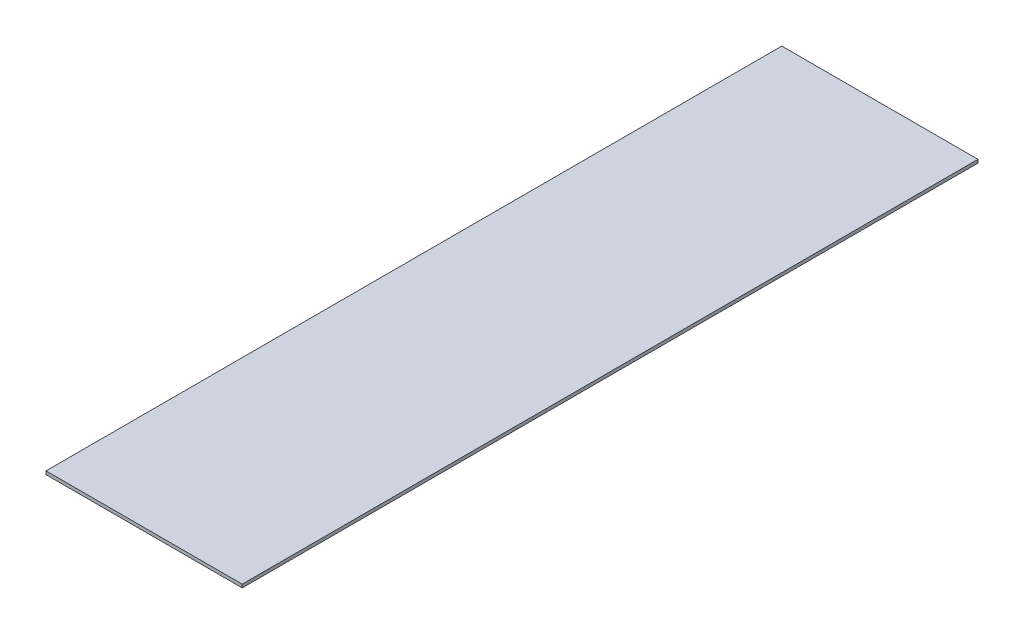
from build123d import *

# Parameters (mm, degrees)
SKETCH1_W           = 120
SKETCH1_H           = 450
BOSS_EXTRUDE1_DEPTH = 2


with BuildPart() as part:
    # Sketch1 → Boss-Extrude1 (new body)
    with BuildSketch(Plane(origin=(0, 0, 0), x_dir=(1, 0, 0), z_dir=(0, 1, 0))):
        with Locations((40, -65.340909091)):
            Rectangle(SKETCH1_W, SKETCH1_H)
    extrude(amount=BOSS_EXTRUDE1_DEPTH)


solid = part.part
